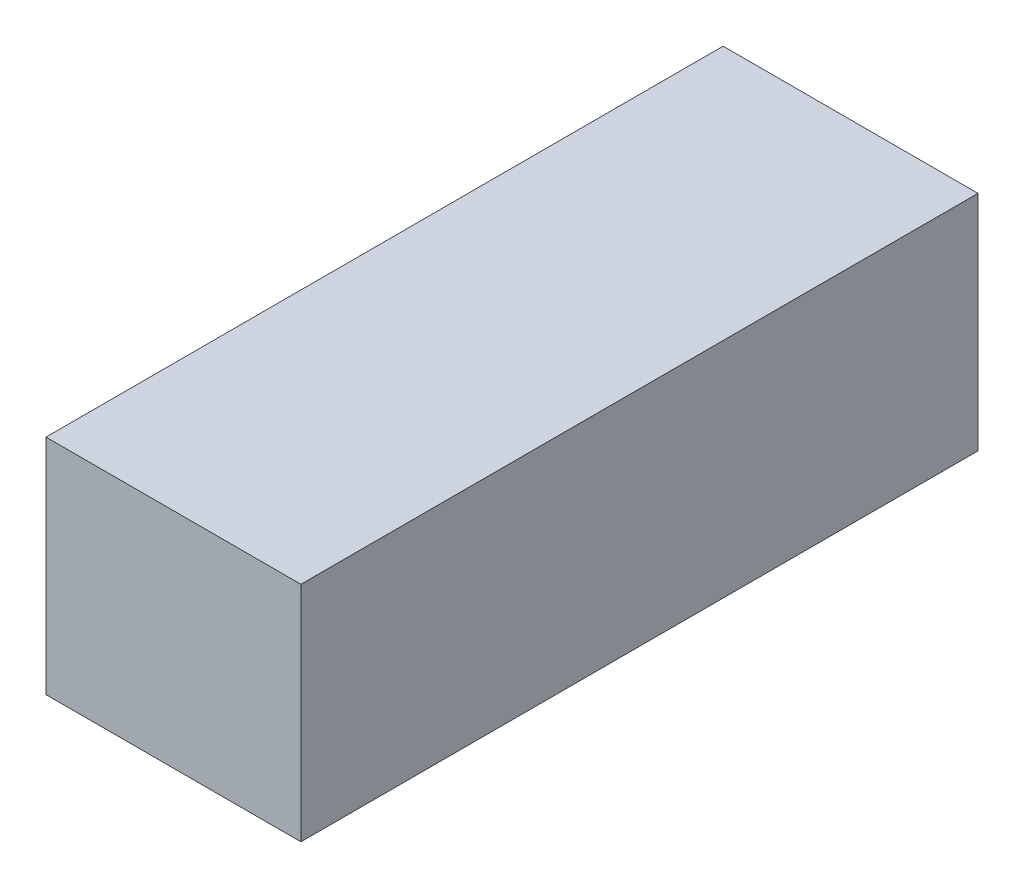
from build123d import *

# Parameters (mm, degrees)
SKETCH1_W           = 50.8
SKETCH1_H           = 44.45
BOSS_EXTRUDE1_DEPTH = 134.9375


with BuildPart() as part:
    # Sketch1 → Boss-Extrude1 (new body)
    with BuildSketch(Plane.XY):
        with Locations((25.4, 22.225)):
            Rectangle(SKETCH1_W, SKETCH1_H)
    extrude(amount=BOSS_EXTRUDE1_DEPTH)


solid = part.part
